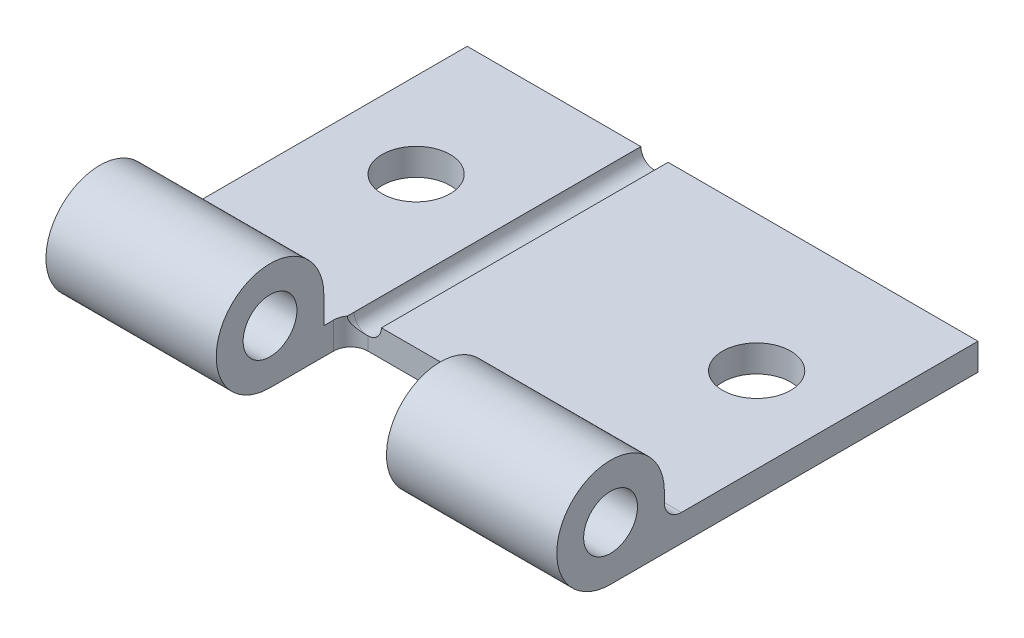
from build123d import *

# Parameters (mm, degrees)
SKETCH1_W              = 25
SKETCH1_H              = 10
BASE_PLATE_DEPTH       = 0.79
SKETCH5_R              = 0.79
PIN_HOLDER_DEPTH       = 5
FILLET1_R              = 0.5
SKETCH6_R              = 1
SCREW_HOLES_DEPTH      = 5
SKETCH7_W              = 5
SKETCH7_H              = 0.79
HINGE_GROOVES_DEPTH    = 1.58
FILLET2_R              = 0.5
SKETCH8_R              = 0.4
SKETCH10_W             = 8.42
SKETCH10_H             = 0.79
EXTERNAL_CUTOFF_DEPTH  = 5
SKETCH11_W             = 8.42
SKETCH11_H             = 0.79
EXTERNAL_CUTOFF2_DEPTH = 5


with BuildPart() as part:
    # Sketch1 → Base Plate (new body)
    with BuildSketch(Plane(origin=(0, 0, 0), x_dir=(1, 0, 0), z_dir=(0, 1, 0))):
        with Locations((4.767605634, 0.253521127)):
            Rectangle(SKETCH1_W, SKETCH1_H)
    extrude(amount=BASE_PLATE_DEPTH)

    # Sketch5 → Pin Holder (add)
    with BuildSketch(Plane(origin=(12.267605634, 0, 0), x_dir=(0, 0, -1), z_dir=(1, 0, 0))):
        with BuildLine():
            Line((-3.956478873, 1.58), (-3.956478873, 0.79))
            ThreePointArc((-3.956478873, 0.79), (-4.187864516, 0.231385643), (-4.746478873, 0))
            Line((-4.746478873, 0), (-5.536478873, 0))
            ThreePointArc((-5.536478873, 0), (-6.653707588, 2.697228714), (-3.956478873, 1.58))
        make_face()
        with Locations((-5.536478873, 1.58)):
            Circle(SKETCH5_R, mode=Mode.SUBTRACT)
    pin_holder = extrude(amount=-PIN_HOLDER_DEPTH)

    # Fillet1
    fillet1_edges = [part.edges().sort_by_distance(p)[0] for p in [
        (9.767605634, 0.79, 3.956478873),
    ]]
    fillet(fillet1_edges, radius=FILLET1_R)

    # Sketch6 → Screw Holes (cut)
    with BuildSketch(Plane(origin=(0, 0.79, 0), x_dir=(1, 0, 0), z_dir=(0, 1, 0))):
        with Locations(Location((9.767605634, 1.253521127, 0), (0, 0, 270))):
            Circle(SKETCH6_R)
    screw_holes = extrude(amount=-SCREW_HOLES_DEPTH, mode=Mode.SUBTRACT)

    # Mirror1: Pin Holder, Screw Holes across plane
    add(pin_holder.mirror(Plane(origin=(4.767605634, 0, 0), x_dir=(0, 0, 1), z_dir=(1, 0, 0))))
    add(screw_holes.mirror(Plane(origin=(4.767605634, 0, 0), x_dir=(0, 0, 1), z_dir=(1, 0, 0))), mode=Mode.SUBTRACT)

    # Sketch7 → Hinge Grooves (cut)
    with BuildSketch(Plane.XY.offset(4.746478873)):
        with Locations((14.767605634, 0.395)):
            Rectangle(SKETCH7_W, SKETCH7_H)
        with Locations((4.767605634, 0.395)):
            Rectangle(SKETCH7_W, SKETCH7_H)
        with Locations((-5.232394366, 0.395)):
            Rectangle(SKETCH7_W, SKETCH7_H)
    extrude(amount=-HINGE_GROOVES_DEPTH, mode=Mode.SUBTRACT)

    # Fillet2
    fillet2_edges = [part.edges().sort_by_distance(p)[0] for p in [
        (7.267605634, 0.395, 3.166478873),
        (2.267605634, 0.395, 3.166478873),
    ]]
    fillet(fillet2_edges, radius=FILLET2_R)

    # Wire Groove: sweep along a path in Sketch9
    with BuildLine(Plane.XZ) as wire_groove_path:
        Line((2.767605634, -5.253521127), (2.767605634, 3.166478873))
        Line((2.767605634, 3.166478873), (2.767605634, 3.884059602))
    # Sketch8 → Wire Groove (sweep, cut)
    with BuildSketch(Plane(origin=(0, 0, -5.253521127), x_dir=(-1, 0, 0), z_dir=(0, 0, -1))):
        with Locations((-2.767605634, 0.79)):
            Circle(SKETCH8_R)
    sweep(path=wire_groove_path.line, mode=Mode.SUBTRACT)

    # Sketch10 → External Cutoff (cut)
    with BuildSketch(Plane.ZY.offset(7.732394366)):
        with Locations((-1.043521127, 0.395)):
            Rectangle(SKETCH10_W, SKETCH10_H)
    extrude(amount=-EXTERNAL_CUTOFF_DEPTH, mode=Mode.SUBTRACT)

    # Sketch11 → External Cutoff2 (cut)
    with BuildSketch(Plane(origin=(17.267605634, 0, 0), x_dir=(0, 0, -1), z_dir=(1, 0, 0))):
        with Locations((1.043521127, 0.395)):
            Rectangle(SKETCH11_W, SKETCH11_H)
    extrude(amount=-EXTERNAL_CUTOFF2_DEPTH, mode=Mode.SUBTRACT)


solid = part.part
